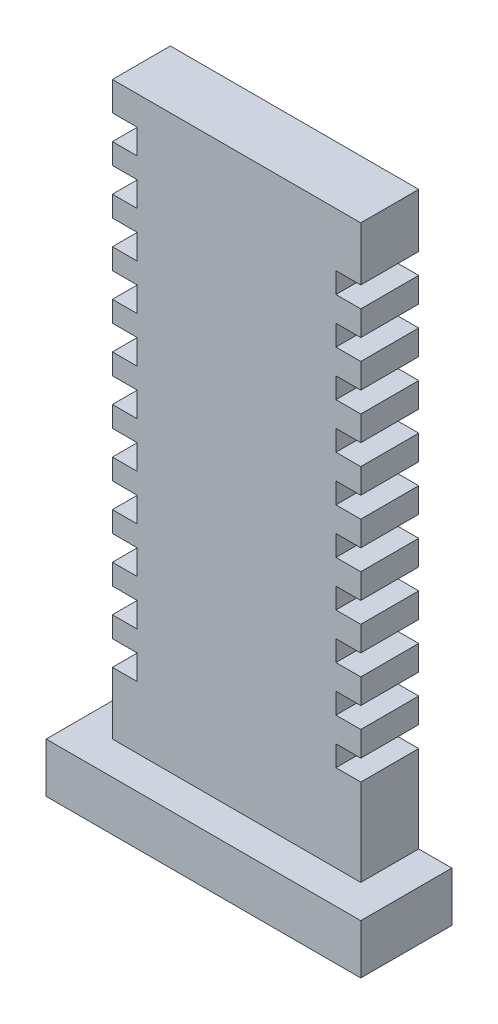
from build123d import *

# Parameters (mm, degrees)
SKETCH1_W           = 60
SKETCH1_H           = 150
BRIDGEPLATE_DEPTH   = 14
SKETCH9_W           = 9
SKETCH9_H           = 6
SKETCH9_H_2         = 5
STRINGNOTCHES_DEPTH = 154.609895515
SKETCH10_W          = 76
SKETCH10_H          = 12
BRIDGEFOOT_DEPTH    = 22


with BuildPart() as part:
    # Sketch1 → BridgePlate (new body)
    with BuildSketch(Plane.XY):
        with Locations((0, 75)):
            Rectangle(SKETCH1_W, SKETCH1_H)
    extrude(amount=BRIDGEPLATE_DEPTH)

    # Sketch9 → StringNotches (cut, through all)
    with BuildSketch(Plane.XY.offset(14)):
        with Locations((-28.5, 30)):
            Rectangle(SKETCH9_W, SKETCH9_H)
        with Locations((-28.5, 41)):
            Rectangle(SKETCH9_W, SKETCH9_H)
        with Locations((-28.5, 52)):
            Rectangle(SKETCH9_W, SKETCH9_H)
        with Locations((-28.5, 63)):
            Rectangle(SKETCH9_W, SKETCH9_H)
        with Locations((-28.5, 74)):
            Rectangle(SKETCH9_W, SKETCH9_H)
        with Locations((-28.5, 85)):
            Rectangle(SKETCH9_W, SKETCH9_H)
        with Locations((-28.5, 96)):
            Rectangle(SKETCH9_W, SKETCH9_H)
        with Locations((-28.5, 107)):
            Rectangle(SKETCH9_W, SKETCH9_H)
        with Locations((-28.5, 118)):
            Rectangle(SKETCH9_W, SKETCH9_H)
        with Locations((-28.5, 129)):
            Rectangle(SKETCH9_W, SKETCH9_H)
        with Locations((-28.5, 140)):
            Rectangle(SKETCH9_W, SKETCH9_H)
        with Locations((28.5, 35.5)):
            Rectangle(SKETCH9_W, SKETCH9_H_2)
        with Locations((28.5, 46.5)):
            Rectangle(SKETCH9_W, SKETCH9_H_2)
        with Locations((28.5, 57.5)):
            Rectangle(SKETCH9_W, SKETCH9_H_2)
        with Locations((28.5, 68.5)):
            Rectangle(SKETCH9_W, SKETCH9_H_2)
        with Locations((28.5, 79.5)):
            Rectangle(SKETCH9_W, SKETCH9_H_2)
        with Locations((28.5, 90.5)):
            Rectangle(SKETCH9_W, SKETCH9_H_2)
        with Locations((28.5, 101.5)):
            Rectangle(SKETCH9_W, SKETCH9_H_2)
        with Locations((28.5, 112.5)):
            Rectangle(SKETCH9_W, SKETCH9_H_2)
        with Locations((28.5, 123.5)):
            Rectangle(SKETCH9_W, SKETCH9_H_2)
        with Locations((28.5, 134.5)):
            Rectangle(SKETCH9_W, SKETCH9_H_2)
    extrude(amount=-STRINGNOTCHES_DEPTH, mode=Mode.SUBTRACT)

    # Sketch10 → BridgeFoot (add)
    with BuildSketch(Plane.XY):
        with Locations((0, 6)):
            Rectangle(SKETCH10_W, SKETCH10_H)
    extrude(amount=BRIDGEFOOT_DEPTH)


solid = part.part
